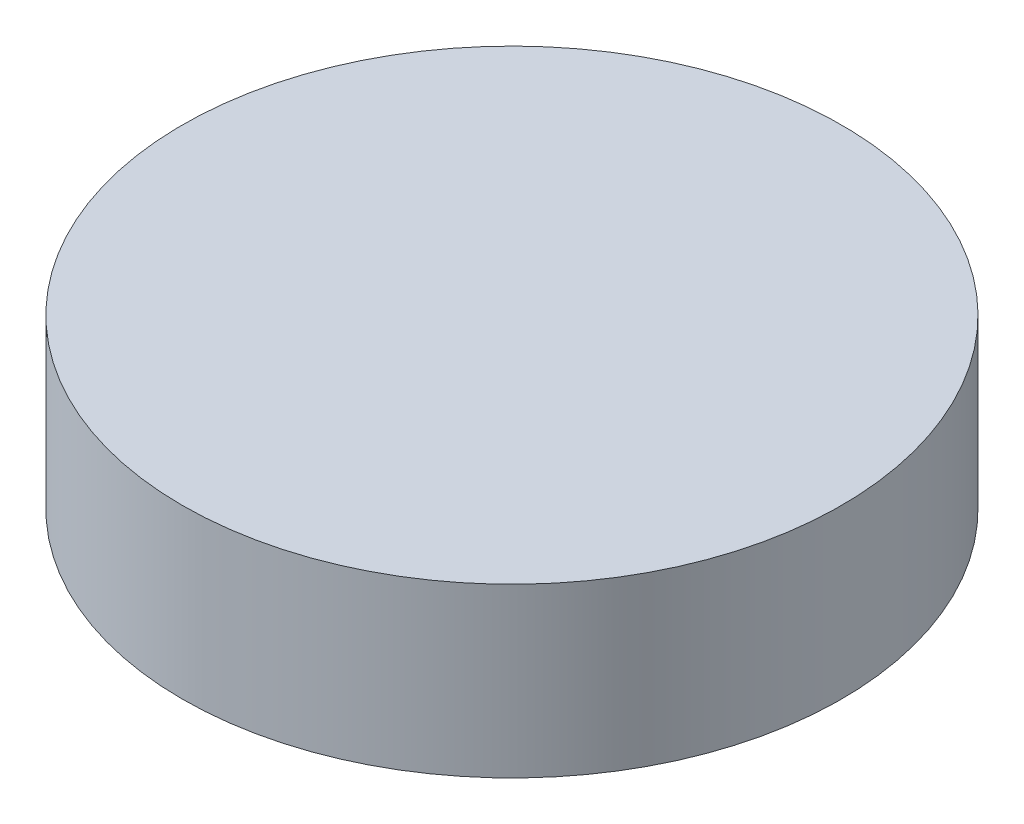
from build123d import *

# Parameters (mm, degrees)
SKETCH1_R           = 69.85
BOSS_EXTRUDE1_DEPTH = 35.56


with BuildPart() as part:
    # Sketch1 → Boss-Extrude1 (new body)
    with BuildSketch(Plane(origin=(0, 0, 0), x_dir=(1, 0, 0), z_dir=(0, 1, 0))):
        with Locations(Location((0, 0, 0), (0, 0, 270))):
            Circle(SKETCH1_R)
    extrude(amount=BOSS_EXTRUDE1_DEPTH)


solid = part.part
